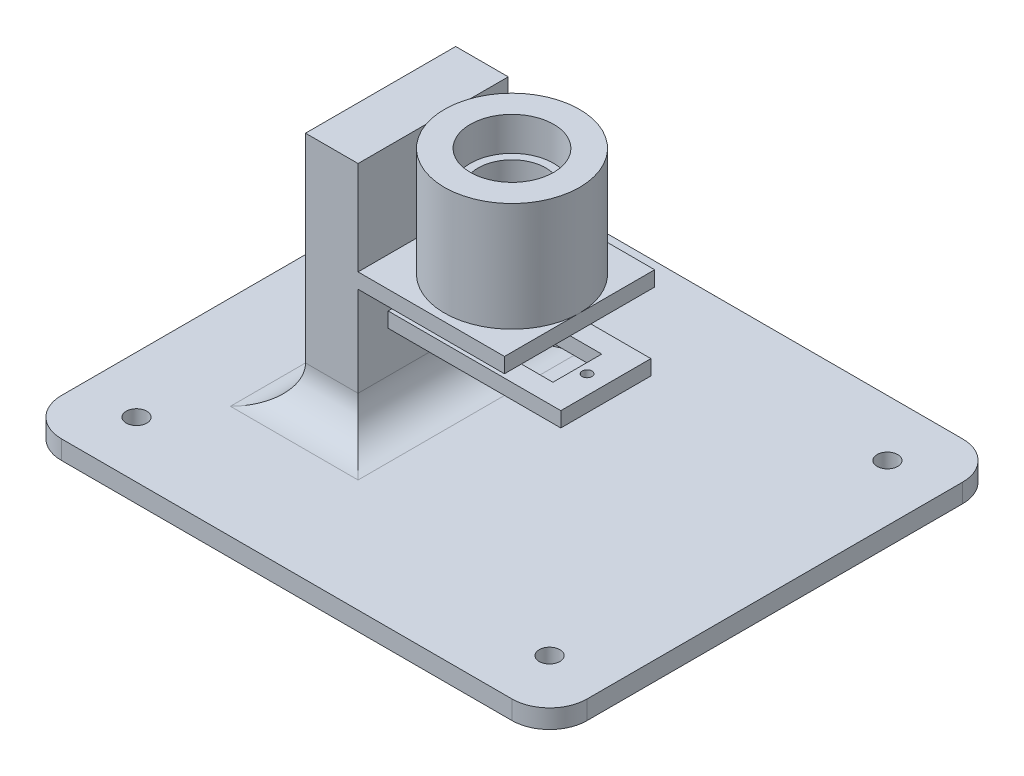
from build123d import *

# Parameters (mm, degrees)
BENCH_FOOTPRINT_140X120_DEPTH           = 5
BACKBONE_START                          = -20
BACKBONE_PROFILE_W                      = 14
BACKBONE_PROFILE_H                      = 63
BACKBONE_DEPTH                          = 40
SERVO_SHELF_START                       = 26
SERVO_SHELF_PROFILE_W                   = 60
SERVO_SHELF_PROFILE_H                   = 24
SERVO_SHELF_DEPTH                       = 4
SERVO_BODY_WINDOW_START                 = 25
SERVO_BODY_WINDOW_PROFILE_W             = 23.8
SERVO_BODY_WINDOW_PROFILE_H             = 13
SERVO_BODY_WINDOW_DEPTH                 = 90.560027933
YAW_SERVO_FASTENERS_START               = 25
YAW_SERVO_FASTENERS_PROFILE_R           = 1.3
YAW_SERVO_FASTENERS_DEPTH               = 90.560027933
BEARING_BRIDGE_START                    = 39
BEARING_BRIDGE_PROFILE_W                = 53
BEARING_BRIDGE_PROFILE_H                = 40
BEARING_BRIDGE_DEPTH                    = 4
BRIDGE_HORN_CLEARANCE_START             = 38
BRIDGE_HORN_CLEARANCE_PROFILE_R         = 14
BRIDGE_HORN_CLEARANCE_DEPTH             = 77.560027933
DRIVE_COLLAR_CHAMBER_START              = 43
DRIVE_COLLAR_CHAMBER_PROFILE_R          = 18
DRIVE_COLLAR_CHAMBER_PROFILE_R_2        = 14
DRIVE_COLLAR_CHAMBER_DEPTH              = 5
BEARING_TOWER_START                     = 48
BEARING_TOWER_PROFILE_R                 = 18
BEARING_TOWER_PROFILE_R_2               = 11.1
BEARING_TOWER_DEPTH                     = 24
BEARING_SEPARATION_SHOULDER_START       = 55
BEARING_SEPARATION_SHOULDER_PROFILE_R   = 11.1
BEARING_SEPARATION_SHOULDER_PROFILE_R_2 = 9
BEARING_SEPARATION_SHOULDER_DEPTH       = 8
BENCH_CLAMP_HOLES_START                 = -1
BENCH_CLAMP_HOLES_PROFILE_R             = 2.75
BENCH_CLAMP_HOLES_DEPTH                 = 118.978630527
FILLET1_R                               = 10


with BuildPart() as part:
    # Bench_footprint_140x120_profile → Bench_footprint_140x120 (new body)
    with BuildSketch(Plane(origin=(0, 0, 0), x_dir=(1, 0, 0), z_dir=(0, 1, 0))):
        with BuildLine():
            Line((-60, -60), (60, -60))
            ThreePointArc((60, -60), (67.071067812, -57.071067812), (70, -50))
            Line((70, -50), (70, 50))
            ThreePointArc((70, 50), (67.071067812, 57.071067812), (60, 60))
            Line((60, 60), (-60, 60))
            ThreePointArc((-60, 60), (-67.071067812, 57.071067812), (-70, 50))
            Line((-70, 50), (-70, -50))
            ThreePointArc((-70, -50), (-67.071067812, -57.071067812), (-60, -60))
        make_face()
    extrude(amount=BENCH_FOOTPRINT_140X120_DEPTH)

    # Backbone_profile → Backbone (add)
    with BuildSketch(Plane.XY.offset(BACKBONE_START)):
        with Locations((-28, 36.5)):
            Rectangle(BACKBONE_PROFILE_W, BACKBONE_PROFILE_H)
    extrude(amount=BACKBONE_DEPTH)

    # Servo_shelf_profile → Servo_shelf (add)
    with BuildSketch(Plane(origin=(0, 0, 0), x_dir=(1, 0, 0), z_dir=(0, 1, 0)).offset(SERVO_SHELF_START)):
        with Locations((-5, 0)):
            Rectangle(SERVO_SHELF_PROFILE_W, SERVO_SHELF_PROFILE_H)
    extrude(amount=SERVO_SHELF_DEPTH)

    # Servo_body_window_profile → Servo_body_window (cut, through all)
    with BuildSketch(Plane(origin=(0, 0, 0), x_dir=(1, 0, 0), z_dir=(0, 1, 0)).offset(SERVO_BODY_WINDOW_START)):
        with Locations((5.5, 0)):
            Rectangle(SERVO_BODY_WINDOW_PROFILE_W, SERVO_BODY_WINDOW_PROFILE_H)
    extrude(amount=SERVO_BODY_WINDOW_DEPTH, mode=Mode.SUBTRACT)

    # Yaw_servo_fasteners_profile → Yaw_servo_fasteners (cut, through all)
    with BuildSketch(Plane(origin=(0, 0, 0), x_dir=(1, 0, 0), z_dir=(0, 1, 0)).offset(YAW_SERVO_FASTENERS_START)):
        with Locations(Location((-9, 0, 0), (0, 0, 90))):
            Circle(YAW_SERVO_FASTENERS_PROFILE_R)
        with Locations(Location((20, 0, 0), (0, 0, 90))):
            Circle(YAW_SERVO_FASTENERS_PROFILE_R)
    extrude(amount=YAW_SERVO_FASTENERS_DEPTH, mode=Mode.SUBTRACT)

    # Bearing_bridge_profile → Bearing_bridge (add)
    with BuildSketch(Plane(origin=(0, 0, 0), x_dir=(1, 0, 0), z_dir=(0, 1, 0)).offset(BEARING_BRIDGE_START)):
        with Locations((-8.5, 0)):
            Rectangle(BEARING_BRIDGE_PROFILE_W, BEARING_BRIDGE_PROFILE_H)
    extrude(amount=BEARING_BRIDGE_DEPTH)

    # Bridge_horn_clearance_profile → Bridge_horn_clearance (cut, through all)
    with BuildSketch(Plane(origin=(0, 0, 0), x_dir=(1, 0, 0), z_dir=(0, 1, 0)).offset(BRIDGE_HORN_CLEARANCE_START)):
        with Locations(Location((0, 0, 0), (0, 0, 90))):
            Circle(BRIDGE_HORN_CLEARANCE_PROFILE_R)
    extrude(amount=BRIDGE_HORN_CLEARANCE_DEPTH, mode=Mode.SUBTRACT)

    # Drive_collar_chamber_profile → Drive_collar_chamber (add)
    with BuildSketch(Plane(origin=(0, 0, 0), x_dir=(1, 0, 0), z_dir=(0, 1, 0)).offset(DRIVE_COLLAR_CHAMBER_START)):
        Circle(DRIVE_COLLAR_CHAMBER_PROFILE_R)
        with Locations(Location((0, 0, 0), (0, 0, 90))):
            Circle(DRIVE_COLLAR_CHAMBER_PROFILE_R_2, mode=Mode.SUBTRACT)
    extrude(amount=DRIVE_COLLAR_CHAMBER_DEPTH)

    # Bearing_tower_profile → Bearing_tower (add)
    with BuildSketch(Plane(origin=(0, 0, 0), x_dir=(1, 0, 0), z_dir=(0, 1, 0)).offset(BEARING_TOWER_START)):
        Circle(BEARING_TOWER_PROFILE_R)
        with Locations(Location((0, 0, 0), (0, 0, 270))):
            Circle(BEARING_TOWER_PROFILE_R_2, mode=Mode.SUBTRACT)
    extrude(amount=BEARING_TOWER_DEPTH)

    # Bearing_separation_shoulder_profile → Bearing_separation_shoulder (add)
    with BuildSketch(Plane(origin=(0, 0, 0), x_dir=(1, 0, 0), z_dir=(0, 1, 0)).offset(BEARING_SEPARATION_SHOULDER_START)):
        with Locations(Location((0, 0, 0), (0, 0, 270))):
            Circle(BEARING_SEPARATION_SHOULDER_PROFILE_R)
        with Locations(Location((0, 0, 0), (0, 0, 270))):
            Circle(BEARING_SEPARATION_SHOULDER_PROFILE_R_2, mode=Mode.SUBTRACT)
    extrude(amount=BEARING_SEPARATION_SHOULDER_DEPTH)

    # Bench_clamp_holes_profile → Bench_clamp_holes (cut, through all)
    with BuildSketch(Plane(origin=(0, 0, 0), x_dir=(1, 0, 0), z_dir=(0, 1, 0)).offset(BENCH_CLAMP_HOLES_START)):
        with Locations(Location((-55, -45, 0), (0, 0, 90))):
            Circle(BENCH_CLAMP_HOLES_PROFILE_R)
        with Locations(Location((55, -45, 0), (0, 0, 90))):
            Circle(BENCH_CLAMP_HOLES_PROFILE_R)
        with Locations(Location((-55, 45, 0), (0, 0, 90))):
            Circle(BENCH_CLAMP_HOLES_PROFILE_R)
        with Locations(Location((55, 45, 0), (0, 0, 90))):
            Circle(BENCH_CLAMP_HOLES_PROFILE_R)
    extrude(amount=BENCH_CLAMP_HOLES_DEPTH, mode=Mode.SUBTRACT)

    # Fillet1
    fillet1_edges = [part.edges().sort_by_distance(p)[0] for p in [
        (-28, 5, -20),
        (-35, 5, 0),
        (-21, 5, 0),
        (-28, 5, 20),
    ]]
    fillet(fillet1_edges, radius=FILLET1_R)


solid = part.part
